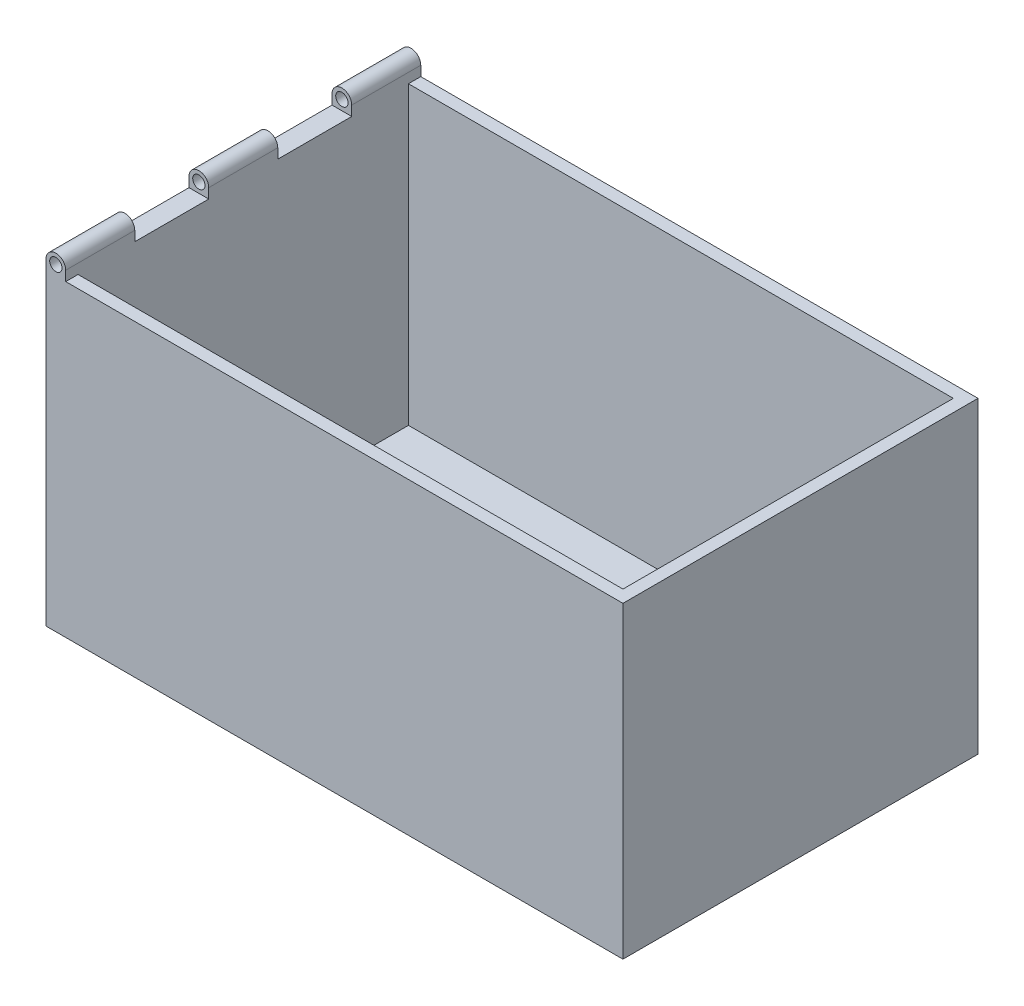
from build123d import *

# Parameters (mm, degrees)
SKETCH1_W               = 117
SKETCH1_H               = 72
BOSS_EXTRUDE1_DEPTH     = 2.5
SKETCH2_W               = 117
SKETCH2_H               = 72
SKETCH2_W_2             = 110.5
SKETCH2_H_2             = 67
BOSS_EXTRUDE2_DEPTH     = 60
SKETCH3_R               = 1.25
BOSS_EXTRUDE3_DEPTH     = 36
CUT_EXTRUDE1_DEPTH      = 94.884237229
CUT_EXTRUDE1_DEPTH_BACK = 94.884237229
SKETCH4_W               = 15
SKETCH4_H               = 4


with BuildPart() as part:
    # Sketch1 → Boss-Extrude1 (new body)
    with BuildSketch(Plane(origin=(0, 0, 0), x_dir=(1, 0, 0), z_dir=(0, 1, 0))):
        Rectangle(SKETCH1_W, SKETCH1_H)
    extrude(amount=-BOSS_EXTRUDE1_DEPTH)

    # Sketch2 → Boss-Extrude2 (add)
    with BuildSketch(Plane(origin=(0, 0, 0), x_dir=(1, 0, 0), z_dir=(0, 1, 0))):
        Rectangle(SKETCH2_W, SKETCH2_H)
        with Locations((0.75, 0)):
            Rectangle(SKETCH2_W_2, SKETCH2_H_2, mode=Mode.SUBTRACT)
    extrude(amount=BOSS_EXTRUDE2_DEPTH)

    # Sketch3 → Boss-Extrude3 (add, symmetric)
    with BuildSketch(Plane.XY):
        with BuildLine():
            Line((-58.5, 62), (-58.5, 60))
            Line((-58.5, 60), (-54.5, 60))
            Line((-54.5, 60), (-54.5, 62))
            ThreePointArc((-54.5, 62), (-56.5, 64), (-58.5, 62))
        make_face()
        with Locations((-56.5, 62)):
            Circle(SKETCH3_R, mode=Mode.SUBTRACT)
    extrude(amount=BOSS_EXTRUDE3_DEPTH, both=True)

    # Sketch4 → Cut-Extrude1 (cut, two sides: drawn at the far end of the back side and taken through both)
    with BuildSketch(Plane(origin=(0, 0, 0), x_dir=(0, 0, -1), z_dir=(1, 0, 0)).offset(-CUT_EXTRUDE1_DEPTH_BACK)):
        with Locations((-14.5, 62)):
            Rectangle(SKETCH4_W, SKETCH4_H)
        with Locations((14.5, 62)):
            Rectangle(SKETCH4_W, SKETCH4_H)
    extrude(amount=CUT_EXTRUDE1_DEPTH + CUT_EXTRUDE1_DEPTH_BACK, mode=Mode.SUBTRACT)


solid = part.part
